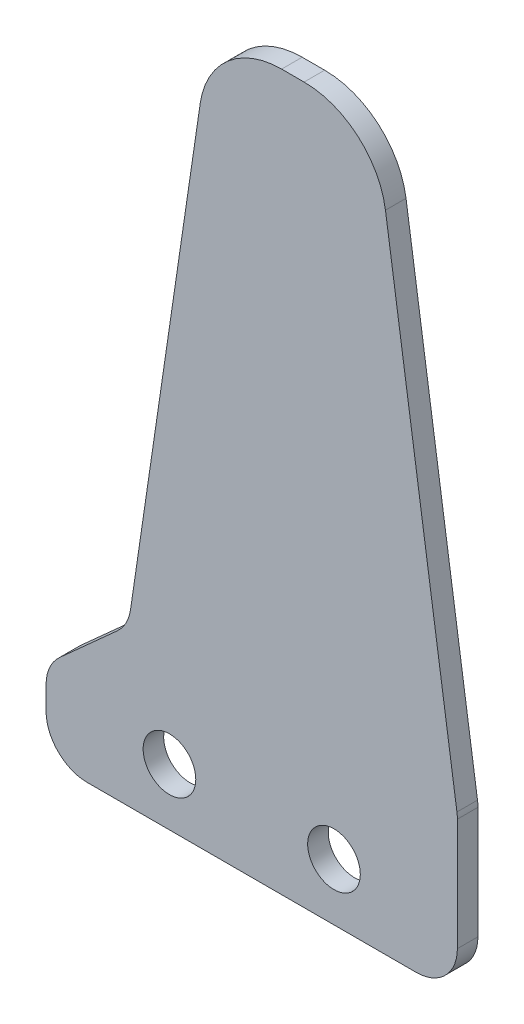
from build123d import *

# Parameters (mm, degrees)
SKETCH1_R           = 2.032
BOSS_EXTRUDE1_DEPTH = 1.5875
FILLET1_R           = 6.35
FILLET2_R           = 3.175


with BuildPart() as part:
    # Sketch1 → Boss-Extrude1 (new body)
    with BuildSketch(Plane.XY):
        Polygon((9.525, -4.392368296), (9.525, 7.671504431), (3.175, 50.8), (-9.525, 50.8), (-15.875, 7.671504431), (-22.225, 1.957631704), (-22.225, -4.392368296), align=None)
        Circle(SKETCH1_R, mode=Mode.SUBTRACT)
        with Locations((-12.7, 0)):
            Circle(SKETCH1_R, mode=Mode.SUBTRACT)
    extrude(amount=BOSS_EXTRUDE1_DEPTH)

    # Fillet1
    fillet1_edges = [part.edges().sort_by_distance(p)[0] for p in [
        (-9.525, 50.8, 0.79375),
        (3.175, 50.8, 0.79375),
    ]]
    fillet(fillet1_edges, radius=FILLET1_R)

    # Fillet2
    fillet2_edges = [part.edges().sort_by_distance(p)[0] for p in [
        (-22.225, -4.392368296, 0.79375),
        (-22.225, 1.957631704, 0.79375),
        (-15.875, 7.671504431, 0.79375),
        (9.525, 7.671504431, 0.79375),
        (9.525, -4.392368296, 0.79375),
    ]]
    fillet(fillet2_edges, radius=FILLET2_R)


solid = part.part
